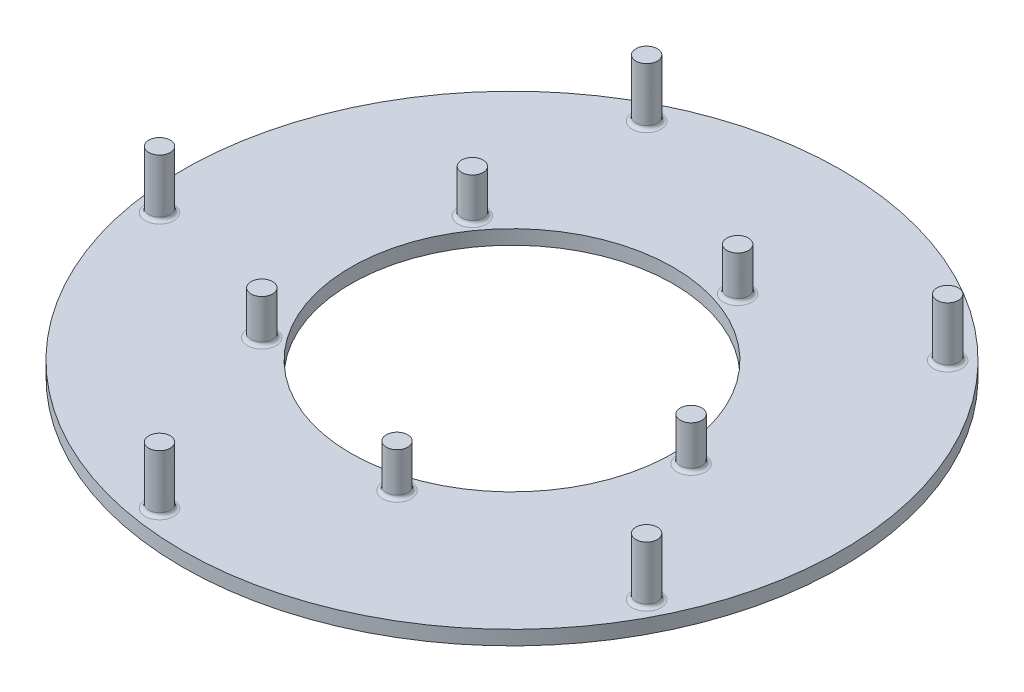
from build123d import *

# Parameters (mm, degrees)
SKETCH1_R                = 46
SKETCH1_R_2              = 22.5
BOSS_EXTRUDE1_DEPTH      = 2
SKETCH2_R                = 1.5
BOSS_EXTRUDE2_DEPTH      = 6
FILLET1_R                = 0.5
SKETCH3_R                = 1.5
BOSS_EXTRUDE3_DEPTH      = 2
CIRPATTERN1_COUNT        = 5
FILLET1_OF_CIRPATTERN1_R = 0.5


with BuildPart() as part:
    # Sketch1 → Boss-Extrude1 (new body)
    with BuildSketch(Plane(origin=(0, 0, 0), x_dir=(1, 0, 0), z_dir=(0, 1, 0))):
        with Locations(Location((0, 0, 0), (0, 0, 270))):
            Circle(SKETCH1_R)
        with Locations(Location((0, 0, 0), (0, 0, 270))):
            Circle(SKETCH1_R_2, mode=Mode.SUBTRACT)
    extrude(amount=BOSS_EXTRUDE1_DEPTH)

    # Sketch2 → Boss-Extrude2 (add)
    with BuildSketch(Plane(origin=(0, 2, 0), x_dir=(1, 0, 0), z_dir=(0, 1, 0))):
        with Locations(Location((25, 0, 0), (0, 0, 270))):
            Circle(SKETCH2_R)
        with Locations(Location((30.405591591, 30.405591591, 0), (0, 0, 270))):
            Circle(SKETCH2_R)
    boss_extrude2 = extrude(amount=BOSS_EXTRUDE2_DEPTH)

    # Fillet1
    fillet1_edges = [part.edges().sort_by_distance(p)[0] for p in [
        (25, 2, -1.5),
        (30.405591591, 2, -31.905591591),
    ]]
    fillet(fillet1_edges, radius=FILLET1_R)

    # Sketch3 → Boss-Extrude3 (add)
    with BuildSketch(Plane(origin=(0, 8, 0), x_dir=(1, 0, 0), z_dir=(0, 1, 0))):
        with Locations(Location((30.405591591, 30.405591591, 0), (0, 0, 270))):
            Circle(SKETCH3_R)
    boss_extrude3 = extrude(amount=BOSS_EXTRUDE3_DEPTH)

    # CirPattern1: Boss-Extrude2, Boss-Extrude3 ×5 about axis
    cirpattern1_axis = Axis((0, 0, 0), (0, 1, 0))
    add([boss_extrude2.rotate(cirpattern1_axis, i * 360 / CIRPATTERN1_COUNT) for i in range(1, CIRPATTERN1_COUNT)])
    add([boss_extrude3.rotate(cirpattern1_axis, i * 360 / CIRPATTERN1_COUNT) for i in range(1, CIRPATTERN1_COUNT)])

    # Fillet1 of CirPattern1
    fillet1_of_cirpattern1_edges = [part.edges().sort_by_distance(p)[0] for p in [
        (6.298840085, 2, -24.239938399),
        (-20.948176263, 2, -38.776806032),
        (-21.107102738, 2, -13.481105816),
        (-43.352276524, 2, 7.940207488),
        (-19.343746981, 2, 15.908156799),
        (-5.845004118, 2, 43.684124137),
        (9.152009634, 2, 23.312887416),
        (39.739865315, 2, 19.058065997),
    ]]
    fillet(fillet1_of_cirpattern1_edges, radius=FILLET1_OF_CIRPATTERN1_R)


solid = part.part
